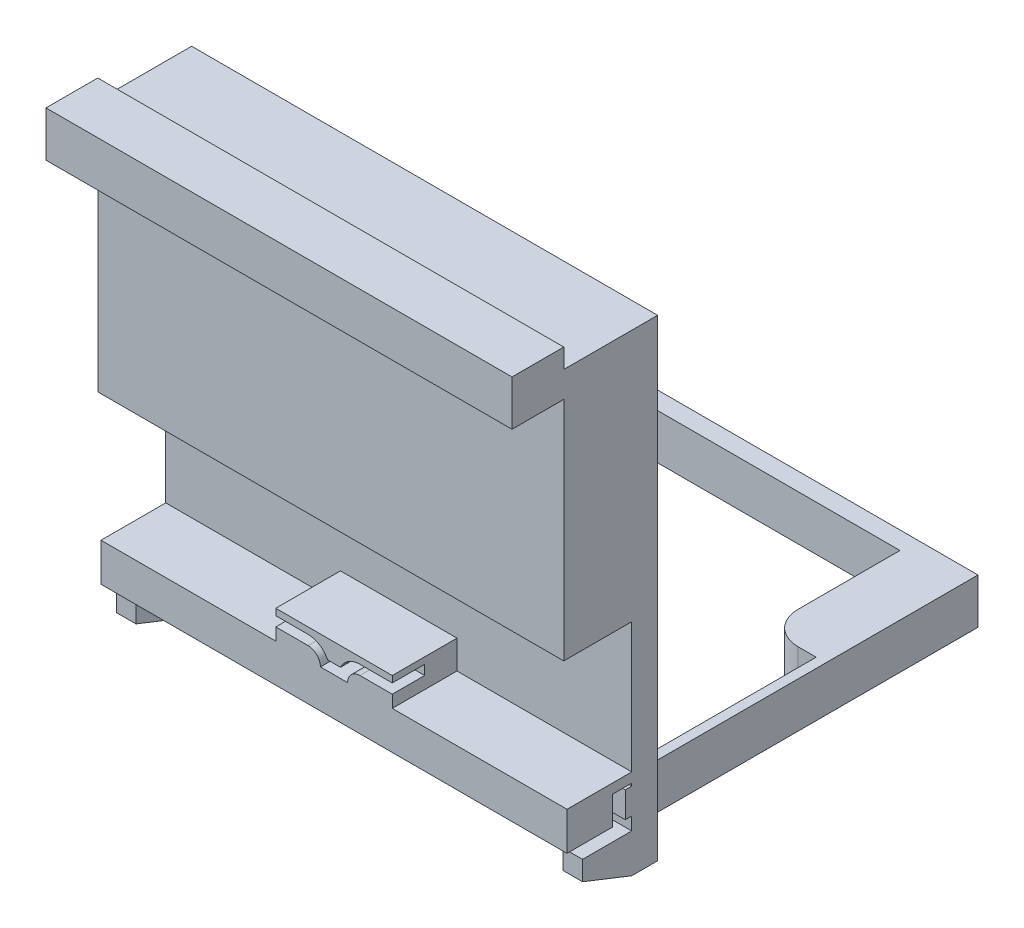
from build123d import *

# Parameters (mm, degrees)
CROQUIS1_W               = 72
CROQUIS1_H               = 74
SALIENTE_EXTRUIR3_DEPTH  = 4
CROQUIS2_W               = 3
CROQUIS2_H               = 6
SALIENTE_EXTRUIR4_DEPTH  = 7.6
CORTAR_EXTRUIR3_DEPTH    = 83.938591741
CROQUIS5_W               = 5
CROQUIS5_H               = 4
SALIENTE_EXTRUIR5_DEPTH  = 1
CROQUIS9_W               = 72
CROQUIS9_H               = 1.5
SALIENTE_EXTRUIR6_DEPTH  = 8
CROQUIS10_W              = 72
CROQUIS10_H              = 5.9
SALIENTE_EXTRUIR7_DEPTH  = 2
CROQUIS11_W              = 10
CROQUIS11_H              = 4.4
SALIENTE_EXTRUIR10_DEPTH = 7
SALIENTE_EXTRUIR14_DEPTH = 10
CROQUIS15_W              = 18
CROQUIS15_H              = 4.4
SALIENTE_EXTRUIR15_DEPTH = 5
CROQUIS16_W              = 72
CROQUIS16_H              = 40
SALIENTE_EXTRUIR16_DEPTH = 10.5
CROQUIS17_W              = 72
CROQUIS17_H              = 5
SALIENTE_EXTRUIR17_DEPTH = 8
CROQUIS18_W              = 72
CROQUIS18_H              = 8
SALIENTE_EXTRUIR19_DEPTH = 2
CROQUIS19_W              = 72
CROQUIS19_H              = 1
CORTAR_EXTRUIR4_DEPTH    = 14.5
CROQUIS20_W              = 59
CROQUIS20_H              = 7
SALIENTE_EXTRUIR20_DEPTH = 65
CROQUIS26_R              = 1.25
CROQUIS26_R_2            = 1.3
CORTAR_EXTRUIR5_DEPTH    = 10
REDONDEO1_R              = 5
CORTAR_EXTRUIR6_REACH    = 103.4
CROQUIS27_W              = 59
CROQUIS27_H              = 9


with BuildPart() as part:
    # Croquis1 → Saliente-Extruir3 (new body)
    with BuildSketch(Plane.XY):
        with Locations((0, -2.5)):
            Rectangle(CROQUIS1_W, CROQUIS1_H)
    extrude(amount=SALIENTE_EXTRUIR3_DEPTH)

    # Croquis2 → Saliente-Extruir4 (add)
    with BuildSketch(Plane.XY.offset(4)):
        with Locations((-34.5, -36.5)):
            Rectangle(CROQUIS2_W, CROQUIS2_H)
        with Locations((34.5, -36.5)):
            Rectangle(CROQUIS2_W, CROQUIS2_H)
    extrude(amount=SALIENTE_EXTRUIR4_DEPTH)

    # Croquis3 → Cortar-Extruir3 (cut, through all)
    with BuildSketch(Plane.ZY.offset(36)):
        Polygon((4, -39.5), (11.6, -36.5), (11.6, -39.5), align=None)
    extrude(amount=-CORTAR_EXTRUIR3_DEPTH, mode=Mode.SUBTRACT)

    # Croquis5 → Saliente-Extruir5 (add)
    with BuildSketch(Plane.XY.offset(4)):
        with Locations((-33.5, -30.5)):
            Rectangle(CROQUIS5_W, CROQUIS5_H)
        with Locations((33.5, -29.5)):
            Rectangle(CROQUIS5_W, CROQUIS5_H)
    extrude(amount=SALIENTE_EXTRUIR5_DEPTH)

    # Croquis9 → Saliente-Extruir6 (add)
    with BuildSketch(Plane.XY.offset(4)):
        with Locations((0, -26.35)):
            Rectangle(CROQUIS9_W, CROQUIS9_H)
    extrude(amount=SALIENTE_EXTRUIR6_DEPTH)

    # Croquis10 → Saliente-Extruir7 (add)
    with BuildSketch(Plane.XY.offset(12)):
        with Locations((0, -28.55)):
            Rectangle(CROQUIS10_W, CROQUIS10_H)
    extrude(amount=SALIENTE_EXTRUIR7_DEPTH)

    # Croquis11 → Saliente-Extruir10 (add)
    with BuildSketch(Plane.XY.offset(14)):
        with Locations((-31, -29.3)):
            Rectangle(CROQUIS11_W, CROQUIS11_H)
        with Locations((31, -29.3)):
            Rectangle(CROQUIS11_W, CROQUIS11_H)
    extrude(amount=-SALIENTE_EXTRUIR10_DEPTH)

    # Croquis14 → Saliente-Extruir14 (add)
    with BuildSketch(Plane.XY.offset(4)):
        with BuildLine():
            Line((-9, -23.7), (-9, -25.6))
            Line((-9, -25.6), (-2.1, -25.6))
            ThreePointArc((-2.1, -25.6), (-2.656497116, -24.256497116), (-4, -23.7))
            Line((-4, -23.7), (-9, -23.7))
        make_face()
        with BuildLine():
            Line((-9, -21.2), (-9, -22.2))
            Line((-9, -22.2), (-4, -22.2))
            ThreePointArc((-4, -22.2), (-2.22447191, -22.714955647), (-1, -24.1))
            Line((-1, -24.1), (1, -24.1))
            ThreePointArc((1, -24.1), (2.22447191, -22.714955647), (4, -22.2))
            Line((4, -22.2), (9, -22.2))
            Line((9, -22.2), (9, -21.2))
            Line((9, -21.2), (-9, -21.2))
        make_face()
        with BuildLine():
            ThreePointArc((4, -23.7), (2.656497116, -24.256497116), (2.1, -25.6))
            Line((2.1, -25.6), (9, -25.6))
            Line((9, -25.6), (9, -23.7))
            Line((9, -23.7), (4, -23.7))
        make_face()
    extrude(amount=SALIENTE_EXTRUIR14_DEPTH)

    # Croquis15 → Saliente-Extruir15 (add)
    with BuildSketch(Plane.XY.offset(4)):
        with Locations((0, -23.4)):
            Rectangle(CROQUIS15_W, CROQUIS15_H)
    extrude(amount=SALIENTE_EXTRUIR15_DEPTH)

    # Croquis16 → Saliente-Extruir16 (add)
    with BuildSketch(Plane.XY.offset(4)):
        with Locations((0, 14.5)):
            Rectangle(CROQUIS16_W, CROQUIS16_H)
    extrude(amount=SALIENTE_EXTRUIR16_DEPTH)

    # Croquis17 → Saliente-Extruir17 (add)
    with BuildSketch(Plane.XY.offset(14.5)):
        with Locations((0, 32)):
            Rectangle(CROQUIS17_W, CROQUIS17_H)
    extrude(amount=SALIENTE_EXTRUIR17_DEPTH)

    # Croquis18 → Saliente-Extruir19 (add)
    with BuildSketch(Plane(origin=(0, 34.5, 0), x_dir=(1, 0, 0), z_dir=(0, 1, 0))):
        with Locations((0, -18.5)):
            Rectangle(CROQUIS18_W, CROQUIS18_H)
    extrude(amount=SALIENTE_EXTRUIR19_DEPTH)

    # Croquis19 → Cortar-Extruir4 (cut)
    with BuildSketch(Plane(origin=(0, 0, 0), x_dir=(-1, 0, 0), z_dir=(0, 0, -1))):
        with Locations((0, 34)):
            Rectangle(CROQUIS19_W, CROQUIS19_H)
    extrude(amount=-CORTAR_EXTRUIR4_DEPTH, mode=Mode.SUBTRACT)

    # Croquis20 → Saliente-Extruir20 (add)
    with BuildSketch(Plane(origin=(0, 0, 0), x_dir=(-1, 0, 0), z_dir=(0, 0, -1))):
        with Locations((0, -36)):
            Rectangle(CROQUIS20_W, CROQUIS20_H)
    extrude(amount=SALIENTE_EXTRUIR20_DEPTH)

    # Croquis26 → Cortar-Extruir5 (cut)
    with BuildSketch(Plane(origin=(0, -32.5, 0), x_dir=(1, 0, 0), z_dir=(0, 1, 0))):
        with Locations(Location((-18, 5, 0), (0, 0, 270))):
            Circle(CROQUIS26_R)
        with Locations(Location((18, 5, 0), (0, 0, 270))):
            Circle(CROQUIS26_R)
        Polygon((20.192818919, 53.25), (-22, 53.25), (-22, 33.25), (-12, 33.25), (-12, 7.5), (28, 7.5), (28, 32.5), (20.192818919, 32.5), align=None)
        with Locations(Location((23, 5, 0), (0, 0, 270))):
            Circle(CROQUIS26_R_2)
        with Locations(Location((-23, 5, 0), (0, 0, 270))):
            Circle(CROQUIS26_R_2)
        with Locations(Location((-24.5, 43.25, 0), (0, 0, 270))):
            Circle(CROQUIS26_R)
    extrude(amount=-CORTAR_EXTRUIR5_DEPTH, mode=Mode.SUBTRACT)

    # Redondeo1
    redondeo1_edges = [part.edges().sort_by_distance(p)[0] for p in [
        (20.192818919, -36, -32.5),
        (-12, -36, -33.25),
    ]]
    fillet(redondeo1_edges, radius=REDONDEO1_R)

    # Croquis27 → Cortar-Extruir6 (cut, up to next)
    with BuildSketch(Plane(origin=(0, -32.5, 0), x_dir=(1, 0, 0), z_dir=(0, 1, 0)), mode=Mode.PRIVATE) as cortar_extruir6_sk1:
        with Locations((0, 60.5)):
            Rectangle(CROQUIS27_W, CROQUIS27_H)
    cortar_extruir6_tool1 = extrude(cortar_extruir6_sk1.sketch, amount=-CORTAR_EXTRUIR6_REACH, mode=Mode.PRIVATE) & part.part
    add(cortar_extruir6_tool1.solids().sort_by_distance((0, -32.5, -60.5))[0], mode=Mode.SUBTRACT)


solid = part.part
